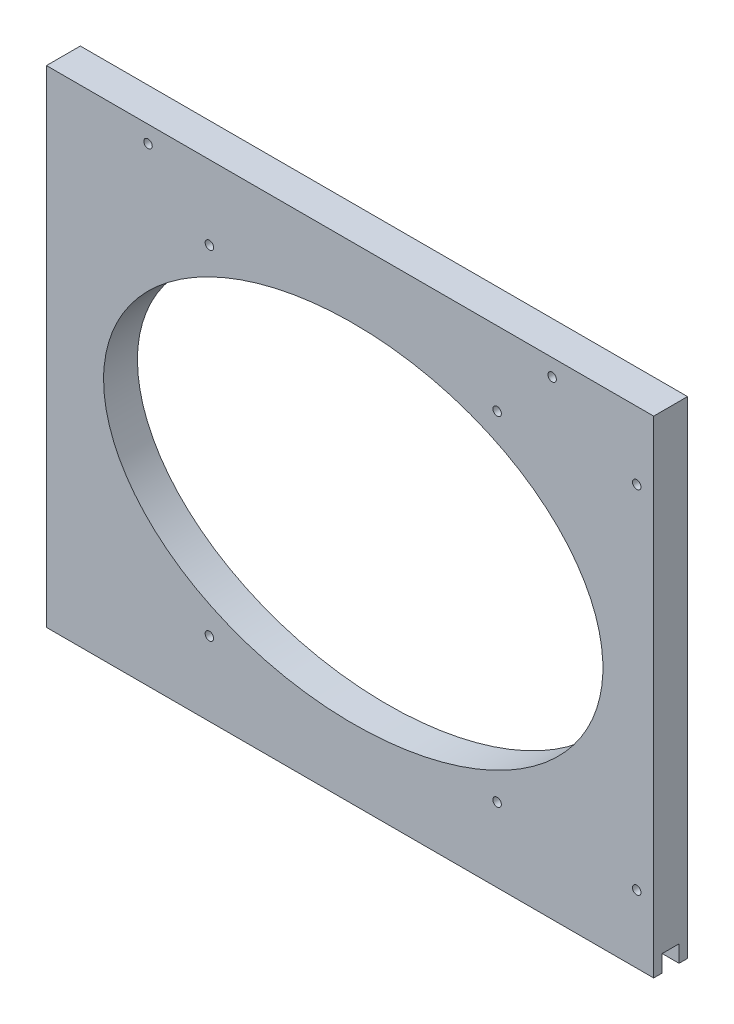
from build123d import *

# Parameters (mm, degrees)
SKETCH2_W          = 227.80625
SKETCH2_H          = 182.5625
EXTRUDE1_DEPTH     = 12.7
SKETCH3_R          = 1.5875
SKETCH3_RX         = 93.6625
SKETCH3_RY         = 65.087499997
CUT_EXTRUDE1_DEPTH = 12.7
CUT_EXTRUDE2_DEPTH = 227.80625


with BuildPart() as part:
    # Sketch2 → Extrude1 (new body)
    with BuildSketch(Plane.XY):
        with Locations((-5372.496875, 1089.81875)):
            Rectangle(SKETCH2_W, SKETCH2_H)
    extrude(amount=-EXTRUDE1_DEPTH)

    # Sketch3 → Cut-Extrude1 (cut)
    with BuildSketch(Plane.XY):
        with Locations((-5448.3, 1174.75)):
            Circle(SKETCH3_R)
        with Locations((-5425.28125, 1153.31875)):
            Circle(SKETCH3_R)
        with Locations((-5296.69375, 1174.75)):
            Circle(SKETCH3_R)
        with Locations((-5317.33125, 1153.31875)):
            Circle(SKETCH3_R)
        with Locations((-5264.94375, 1155.7)):
            Circle(SKETCH3_R)
        with Locations((-5264.94375, 1023.9375)):
            Circle(SKETCH3_R)
        with Locations((-5317.33125, 1026.31875)):
            Circle(SKETCH3_R)
        with Locations((-5425.28125, 1026.31875)):
            Circle(SKETCH3_R)
        with Locations(Location((-5371.30625, 1089.81875), (0, 0, 180))):
            Ellipse(SKETCH3_RX, SKETCH3_RY)
    extrude(amount=-CUT_EXTRUDE1_DEPTH, mode=Mode.SUBTRACT)

    # Sketch4 → Cut-Extrude2 (cut)
    with BuildSketch(Plane(origin=(-5258.59375, 0, 0), x_dir=(0, 0, -1), z_dir=(1, 0, 0))):
        Polygon((6.35, 998.5375), (3.175, 998.5375), (3.175, 1004.8875), (9.525, 1004.8875), (9.525, 998.5375), align=None)
    extrude(amount=-CUT_EXTRUDE2_DEPTH, mode=Mode.SUBTRACT)


solid = part.part
